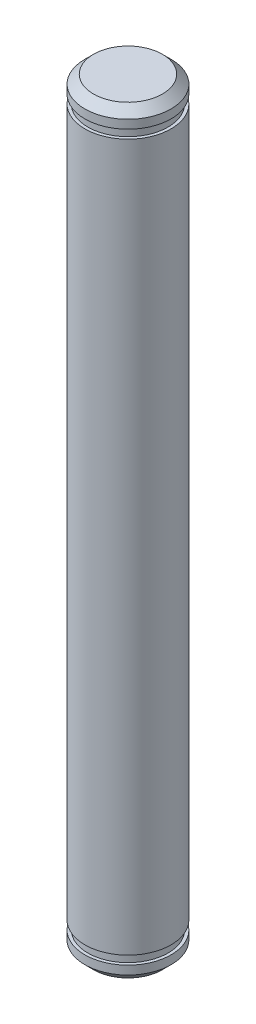
from build123d import *

# Parameters (mm, degrees)
CHAMFER_1_SIZE      = 1
CUT_EXTRUDE_START   = -3
SKETCH_2_R          = 5
SKETCH_2_R_2        = 4.65
CUT_EXTRUDE_1_DEPTH = 1


with BuildPart() as part:
    # 草图1 → 旋转1 (revolve)
    with BuildSketch(Plane.XY, mode=Mode.PRIVATE) as revolve_1_sk:
        Polygon((0, 44), (5, 44), (5, 29), (5, -29), (5, -44), (0, -44), align=None)
    revolve(revolve_1_sk.sketch.rotate(Axis((0, 44, 0), (0, -1, 0)), 180), axis=Axis((0, 44, 0), (0, -1, 0)))

    # 倒角1
    chamfer_1_edges = [part.edges().sort_by_distance(p)[0] for p in [
        (5, -44, 0),
        (5, 44, 0),
    ]]
    chamfer(chamfer_1_edges, length=CHAMFER_1_SIZE)

    # 草图2 → 切除-拉伸1 (cut)
    with BuildSketch(Plane(origin=(0, 44, 0), x_dir=(1, 0, 0), z_dir=(0, 1, 0)).offset(CUT_EXTRUDE_START)):
        with Locations(Location((0, 0, 0), (0, 0, 180))):
            Circle(SKETCH_2_R)
        with Locations(Location((0, 0, 0), (0, 0, 180))):
            Circle(SKETCH_2_R_2, mode=Mode.SUBTRACT)
    cut_extrude_1 = extrude(amount=CUT_EXTRUDE_1_DEPTH, mode=Mode.SUBTRACT)

    # 镜向1: 切除-拉伸1 across plane
    add(cut_extrude_1.mirror(Plane.ZX), mode=Mode.SUBTRACT)


solid = part.part
